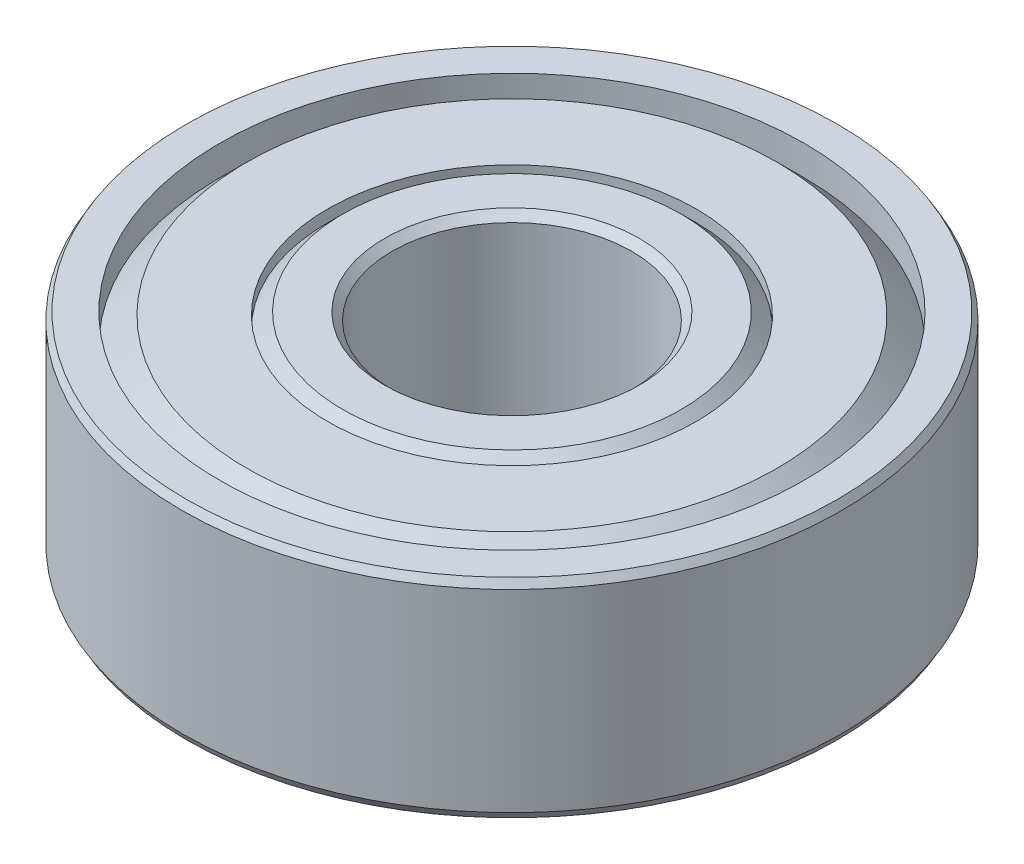
from build123d import *

# Parameters (mm, degrees)
CROQUIS1_R              = 11
CROQUIS1_R_2            = 4
SALIENTE_EXTRUIR1_DEPTH = 6.95
CHAFL_N1_SIZE           = 0.25
CHAFL_N2_SIZE           = 0.25
CHAFL_N2_SIZE2          = 0.144337567


with BuildPart() as part:
    # Croquis1 → Saliente-Extruir1 (new body)
    with BuildSketch(Plane(origin=(0, 0, 0), x_dir=(1, 0, 0), z_dir=(0, 1, 0))):
        with Locations(Location((0, 0, 0), (0, 0, 270))):
            Circle(CROQUIS1_R)
        with Locations(Location((0, 0, 0), (0, 0, 270))):
            Circle(CROQUIS1_R_2, mode=Mode.SUBTRACT)
    extrude(amount=SALIENTE_EXTRUIR1_DEPTH)

    # Croquis2 → Cortar-Revolución1 (revolve, cut)
    with BuildSketch(Plane.XY, mode=Mode.PRIVATE) as cortar_revoluci_n1_sk:
        Polygon((-9.75, 6.95), (-9.75, 5.95), (-8.85, 6.85), (-6.15, 6.85), (-6.15, 6.45), (-5.65, 6.95), align=None)
        Polygon((-8.85, 0.1), (-6.15, 0.1), (-6.15, 0.5), (-5.65, 0), (-9.75, 0), (-9.75, 1), align=None)
    revolve(cortar_revoluci_n1_sk.sketch.rotate(Axis((0, 0, 0), (0, 1, 0)), 270), axis=Axis((0, 0, 0), (0, 1, 0)), mode=Mode.SUBTRACT)

    # Chaflán1
    chafl_n1_edges = [part.edges().sort_by_distance(p)[0] for p in [
        (0, 0, -4),
        (0, 6.95, -4),
    ]]
    chamfer(chafl_n1_edges, length=CHAFL_N1_SIZE)

    # Chaflán2
    chafl_n2_edges = [part.edges().sort_by_distance(p)[0] for p in [
        (0, 0, -11),
        (0, 6.95, -11),
    ]]
    chafl_n2_side = [part.faces().sort_by_distance(p)[0] for p in [
        (0, 3.475, -11),
    ]]
    chamfer(chafl_n2_edges, length=CHAFL_N2_SIZE, length2=CHAFL_N2_SIZE2, reference=chafl_n2_side[0])


solid = part.part
